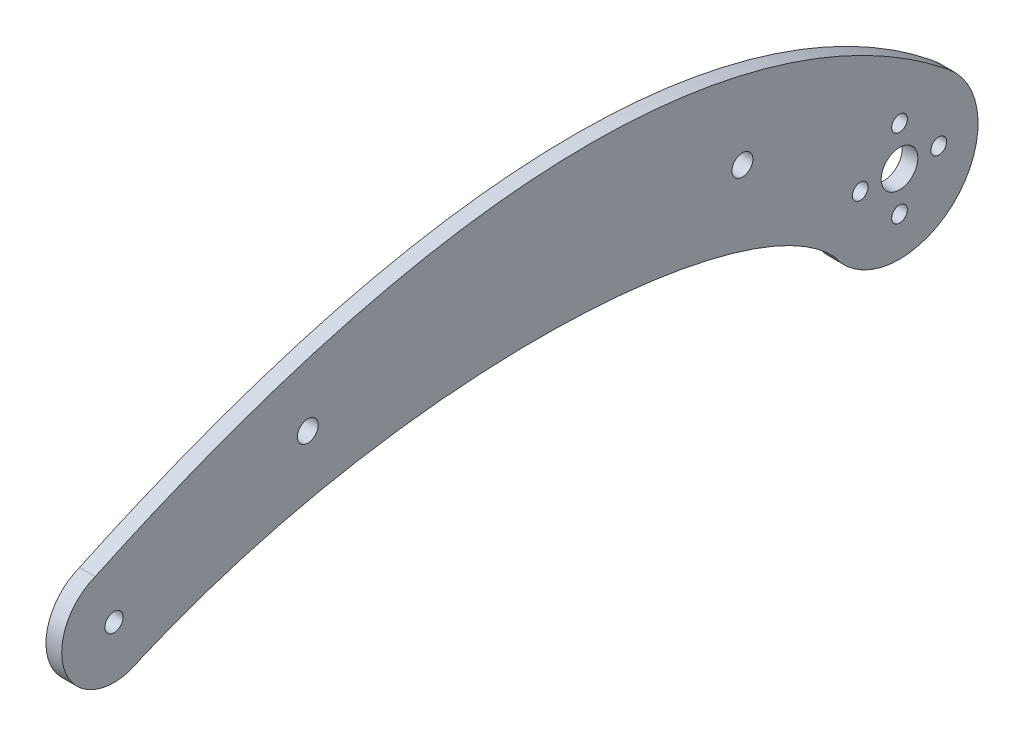
from build123d import *

# Parameters (mm, degrees)
CROQUIS1_R              = 1.75
CROQUIS1_R_2            = 3.5
CROQUIS1_R_3            = 2
CROQUIS1_R_4            = 1.5
SALIENTE_EXTRUIR1_DEPTH = 3


with BuildPart() as part:
    # Croquis1 → Saliente-Extruir1 (new body)
    with BuildSketch(Plane(origin=(0, 0, 0), x_dir=(0, 0, -1), z_dir=(1, 0, 0))):
        with BuildLine():
            ThreePointArc((-12.479760771, -8.321993217), (10.178991806, -11.017627957), (9.281950646, 11.783267467))
            add(Edge.make_bspline(
                [(-153.589400871, 9.333606023), (-52.027464553, 57.017454048), (-3.028685523, 21.666117386), (9.281950646, 11.783267467)],
                knots=[0, 0, 0, 0, 1, 1, 1, 1], degree=3))
            ThreePointArc((-153.589400871, 9.333606023), (-158.998047864, -4.362927301), (-144.894564169, -8.598518767))
            add(Edge.make_bspline(
                [(-144.894564169, -8.598518767), (-94.399563679, 13.089335746), (-29.021790265, 9.608207487), (-12.479760771, -8.321993217)],
                knots=[0, 0, 0, 0, 1, 1, 1, 1], degree=3))
        make_face()
        with Locations((-150, 0)):
            Circle(CROQUIS1_R, mode=Mode.SUBTRACT)
        Circle(CROQUIS1_R_2, mode=Mode.SUBTRACT)
        with Locations((-113, 13.11718)):
            Circle(CROQUIS1_R_3, mode=Mode.SUBTRACT)
        with Locations((-30, 15.614781046)):
            Circle(CROQUIS1_R_3, mode=Mode.SUBTRACT)
        with Locations((-7.5, 0)):
            Circle(CROQUIS1_R_4, mode=Mode.SUBTRACT)
        with Locations((0, -7.5)):
            Circle(CROQUIS1_R_4, mode=Mode.SUBTRACT)
        with Locations((0, 7.5)):
            Circle(CROQUIS1_R_4, mode=Mode.SUBTRACT)
        with Locations((7.5, 0)):
            Circle(CROQUIS1_R_4, mode=Mode.SUBTRACT)
    extrude(amount=SALIENTE_EXTRUIR1_DEPTH)


solid = part.part
